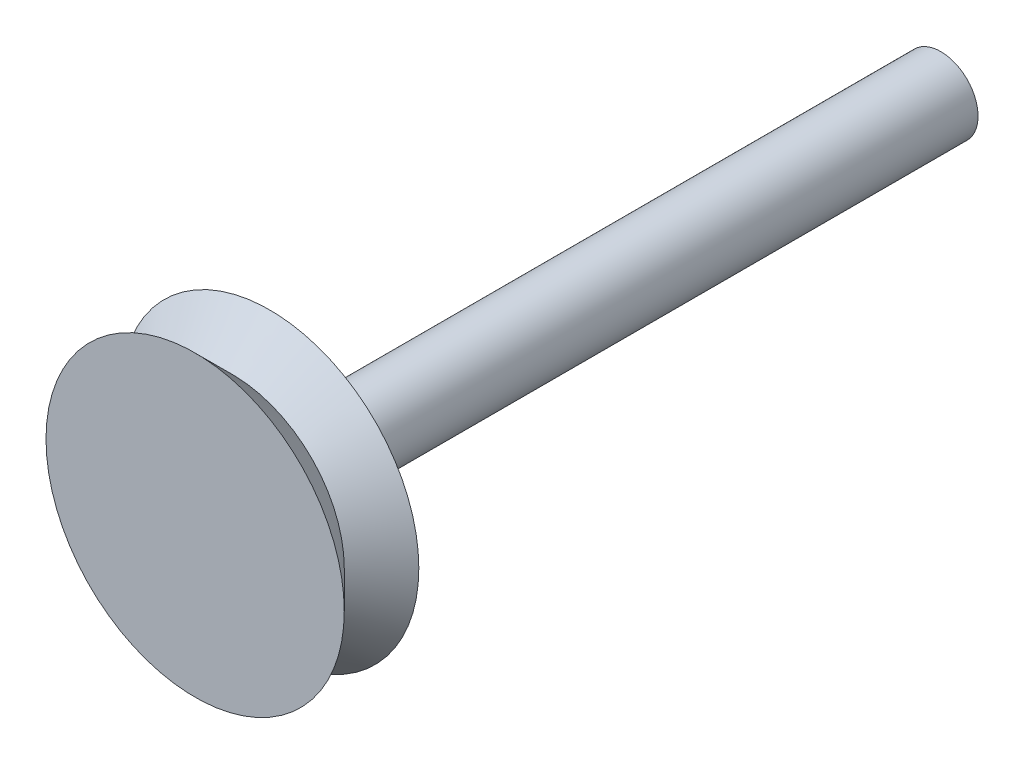
from build123d import *

# Parameters (mm, degrees)
SKETCH1_R           = 4
BOSS_EXTRUDE1_DEPTH = 2
SKETCH2_R           = 1
BOSS_EXTRUDE2_DEPTH = 18


with BuildPart() as part:
    # Sketch1 → Boss-Extrude1 (new body)
    with BuildSketch(Plane.XY):
        Circle(SKETCH1_R)
    extrude(amount=BOSS_EXTRUDE1_DEPTH)

    # Sketch2 → Boss-Extrude2 (add)
    with BuildSketch(Plane(origin=(0, 0, 0), x_dir=(-1, 0, 0), z_dir=(0, 0, -1))):
        Circle(SKETCH2_R)
    extrude(amount=BOSS_EXTRUDE2_DEPTH)

    # Sketch3 → Cut-Revolve1 (revolve, cut)
    with BuildSketch(Plane(origin=(0, 0, 0), x_dir=(0, 0, -1), z_dir=(1, 0, 0)), mode=Mode.PRIVATE) as cut_revolve1_sk:
        Polygon((-2, 4), (-1, 3), (0, 4), align=None)
    revolve(cut_revolve1_sk.sketch.rotate(Axis((0, 0, 3.115097116), (0, 0, -1)), 90), axis=Axis((0, 0, 3.115097116), (0, 0, -1)), mode=Mode.SUBTRACT)


solid = part.part
